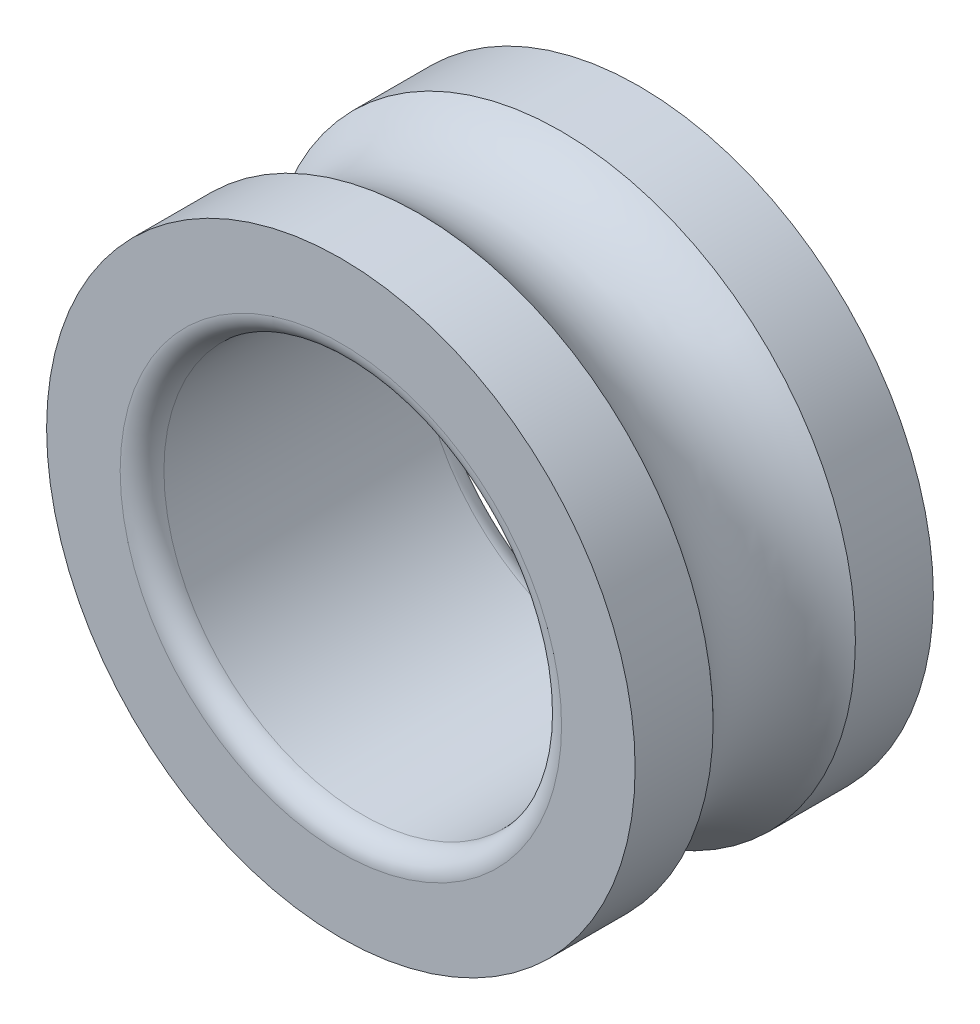
from build123d import *

# Parameters (mm, degrees)
CONG_1_R       = 1.1
ECHELLE1_SCALE = 0.69


with BuildPart() as part:
    # Esquisse2 → Révolution1 (revolve)
    with BuildSketch(Plane(origin=(0, 0, 0), x_dir=(0, 0, -1), z_dir=(1, 0, 0)), mode=Mode.PRIVATE) as r_volution1_sk:
        with BuildLine():
            Line((-7.5, 14.8), (-7.5, 10))
            Line((-7.5, 10), (7.5, 10))
            Line((7.5, 10), (7.5, 14.8))
            Line((7.5, 14.8), (3.577708764, 14.8))
            ThreePointArc((3.577708764, 14.8), (0, 13.2), (-3.577708764, 14.8))
            Line((-3.577708764, 14.8), (-7.5, 14.8))
        make_face()
    revolve(r_volution1_sk.sketch.rotate(Axis((0, 0, 0), (0, 0, 1)), 90), axis=Axis((0, 0, 0), (0, 0, 1)))

    # Congé1
    cong_1_edges = [part.edges().sort_by_distance(p)[0] for p in [
        (10, 0, -7.5),
        (10, 0, 7.5),
    ]]
    fillet(cong_1_edges, radius=CONG_1_R)


with BuildPart() as part_1:
    # Echelle1: scaled about (0, 0, 0)
    add(part.part.scale(ECHELLE1_SCALE))


solid = part_1.part
